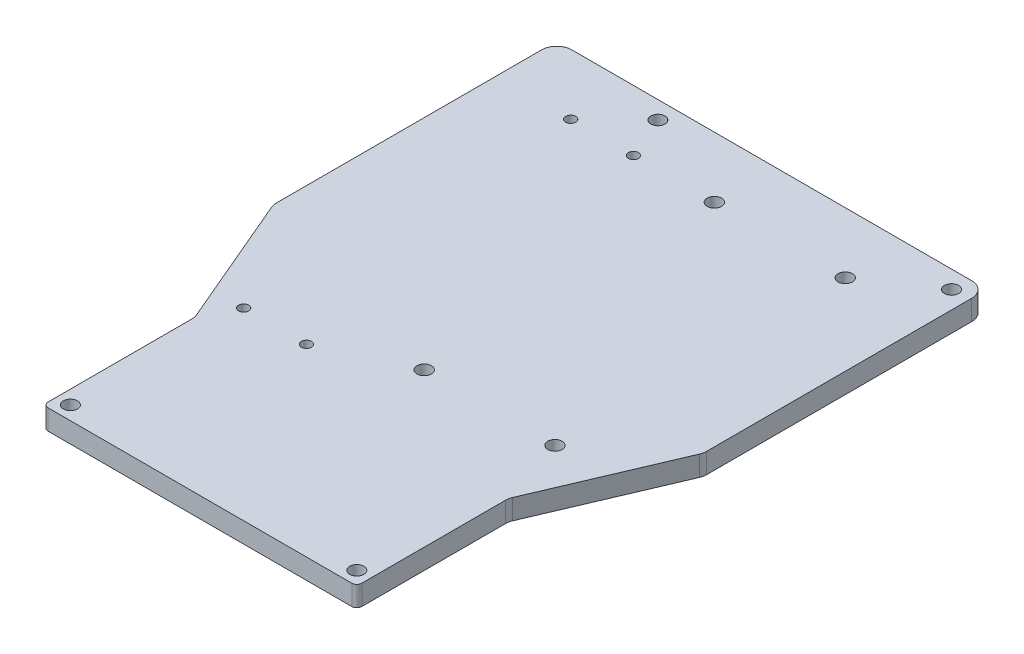
from build123d import *

# Parameters (mm, degrees)
BOSS_EXTRUDE1_DEPTH = 4
SKETCH2_R           = 1.4
SKETCH2_R_2         = 1.425
SKETCH2_R_3         = 1
CUT_EXTRUDE1_DEPTH  = 96.117033175


with BuildPart() as part:
    # Sketch1 → Boss-Extrude1 (new body)
    with BuildSketch(Plane(origin=(0, 0, 0), x_dir=(1, 0, 0), z_dir=(0, 1, 0))):
        with BuildLine():
            Line((-42.260071937, -28.563309365), (-31.239928063, -54.436690635))
            ThreePointArc((-31.239928063, -54.436690635), (-31.060593954, -55.012366758), (-31, -55.61227683))
            Line((-31, -55.61227683), (-31, -84))
            ThreePointArc((-31, -84), (-30.707106781, -84.707106781), (-30, -85))
            Line((-30, -85), (30, -85))
            ThreePointArc((30, -85), (30.707106781, -84.707106781), (31, -84))
            Line((31, -84), (31, -55.61227683))
            ThreePointArc((31, -55.61227683), (31.060593954, -55.012366758), (31.239928063, -54.436690635))
            Line((31.239928063, -54.436690635), (42.260071937, -28.563309365))
            ThreePointArc((42.260071937, -28.563309365), (42.439406046, -27.987633242), (42.5, -27.38772317))
            Line((42.5, -27.38772317), (42.5, 25))
            ThreePointArc((42.5, 25), (41.621320344, 27.121320344), (39.5, 28))
            Line((39.5, 28), (-39.5, 28))
            ThreePointArc((-39.5, 28), (-41.621320344, 27.121320344), (-42.5, 25))
            Line((-42.5, 25), (-42.5, -27.38772317))
            ThreePointArc((-42.5, -27.38772317), (-42.439406046, -27.987633242), (-42.260071937, -28.563309365))
        make_face()
    extrude(amount=BOSS_EXTRUDE1_DEPTH)

    # Sketch2 → Cut-Extrude1 (cut, through all)
    with BuildSketch(Plane(origin=(0, 4, 0), x_dir=(1, 0, 0), z_dir=(0, 1, 0))):
        with Locations(Location((39, 24.5, 0), (0, 0, 270))):
            Circle(SKETCH2_R)
        with Locations(Location((-19, 24.5, 0), (0, 0, 270))):
            Circle(SKETCH2_R)
        with Locations(Location((-28.3, -82.3, 0), (0, 0, 270))):
            Circle(SKETCH2_R)
        with Locations(Location((28.3, -82.3, 0), (0, 0, 270))):
            Circle(SKETCH2_R)
        with Locations(Location((26.5, 16, 0), (0, 0, 270))):
            Circle(SKETCH2_R_2)
        with Locations(Location((0.65, 16, 0), (0, 0, 270))):
            Circle(SKETCH2_R_2)
        with Locations(Location((26.5, -41.35, 0), (0, 0, 270))):
            Circle(SKETCH2_R_2)
        with Locations(Location((0.65, -41.35, 0), (0, 0, 270))):
            Circle(SKETCH2_R_2)
        with Locations(Location((-15.35, 16, 0), (0, 0, 270))):
            Circle(SKETCH2_R_3)
        with Locations(Location((-27.75, 16, 0), (0, 0, 270))):
            Circle(SKETCH2_R_3)
        with Locations(Location((-15.35, -48.6, 0), (0, 0, 270))):
            Circle(SKETCH2_R_3)
        with Locations(Location((-27.75, -48.6, 0), (0, 0, 270))):
            Circle(SKETCH2_R_3)
    extrude(amount=-CUT_EXTRUDE1_DEPTH, mode=Mode.SUBTRACT)


solid = part.part
